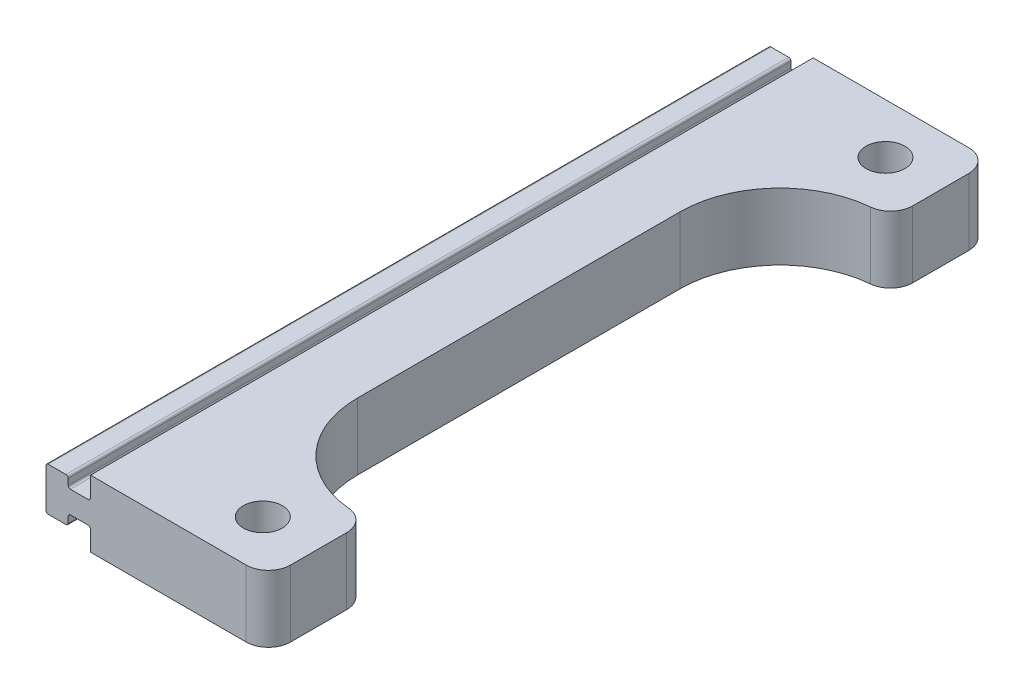
from build123d import *

# Parameters (mm, degrees)
SALIENTE_EXTRUIR1_DEPTH = 6
CROQUIS2_R              = 1.75
CORTAR_EXTRUIR1_DEPTH   = 6
CORTAR_EXTRUIR2_DEPTH   = 67.977608199
REDONDEO1_R             = 0.2
REDONDEO2_R             = 2


with BuildPart() as part:
    # Croquis1 → Saliente-Extruir1 (new body)
    with BuildSketch(Plane(origin=(0, 0, 0), x_dir=(1, 0, 0), z_dir=(0, 1, 0))):
        with BuildLine():
            Line((-5, 32.5), (5, 32.5))
            Line((5, 32.5), (15, 32.5))
            Line((15, 32.5), (15, 23.5))
            Line((15, 23.5), (14, 23.5))
            ThreePointArc((14, 23.5), (7.636038969, 20.863961031), (5, 14.5))
            Line((5, 14.5), (5, -14.5))
            ThreePointArc((5, -14.5), (7.636038969, -20.863961031), (14, -23.5))
            Line((14, -23.5), (15, -23.5))
            Line((15, -23.5), (15, -32.5))
            Line((15, -32.5), (5, -32.5))
            Line((5, -32.5), (-5, -32.5))
            Line((-5, -32.5), (-5, 32.5))
        make_face()
    extrude(amount=SALIENTE_EXTRUIR1_DEPTH)

    # Croquis2 → Cortar-Extruir1 (cut)
    with BuildSketch(Plane(origin=(0, 6, 0), x_dir=(1, 0, 0), z_dir=(0, 1, 0))):
        with Locations(Location((10, -28, 0), (0, 0, 270))):
            Circle(CROQUIS2_R)
        with Locations(Location((10, 28, 0), (0, 0, 90))):
            Circle(CROQUIS2_R)
    extrude(amount=-CORTAR_EXTRUIR1_DEPTH, mode=Mode.SUBTRACT)

    # Croquis4 → Cortar-Extruir2 (cut, through all)
    with BuildSketch(Plane.XY.offset(32.5)):
        Polygon((-5, 0), (-1, 0), (-1, 2), (-3, 2), (-3, 1.05), (-5, 1.05), align=None)
        Polygon((-5, 6), (-1, 6), (-1, 4), (-3, 4), (-3, 4.95), (-5, 4.95), align=None)
    extrude(amount=-CORTAR_EXTRUIR2_DEPTH, mode=Mode.SUBTRACT)

    # Redondeo1
    redondeo1_edges = [part.edges().sort_by_distance(p)[0] for p in [
        (-5, 1.05, 0),
        (-3, 1.05, 0),
        (-3, 2, 0),
        (-1, 2, 0),
        (-5, 4.95, 0),
        (-1, 4, 0),
        (-3, 4, 0),
        (-3, 4.95, 0),
    ]]
    fillet(redondeo1_edges, radius=REDONDEO1_R)

    # Redondeo2
    redondeo2_edges = [part.edges().sort_by_distance(p)[0] for p in [
        (15, 3, 32.5),
        (15, 3, 23.5),
        (15, 3, -23.5),
        (15, 3, -32.5),
    ]]
    fillet(redondeo2_edges, radius=REDONDEO2_R)


solid = part.part
